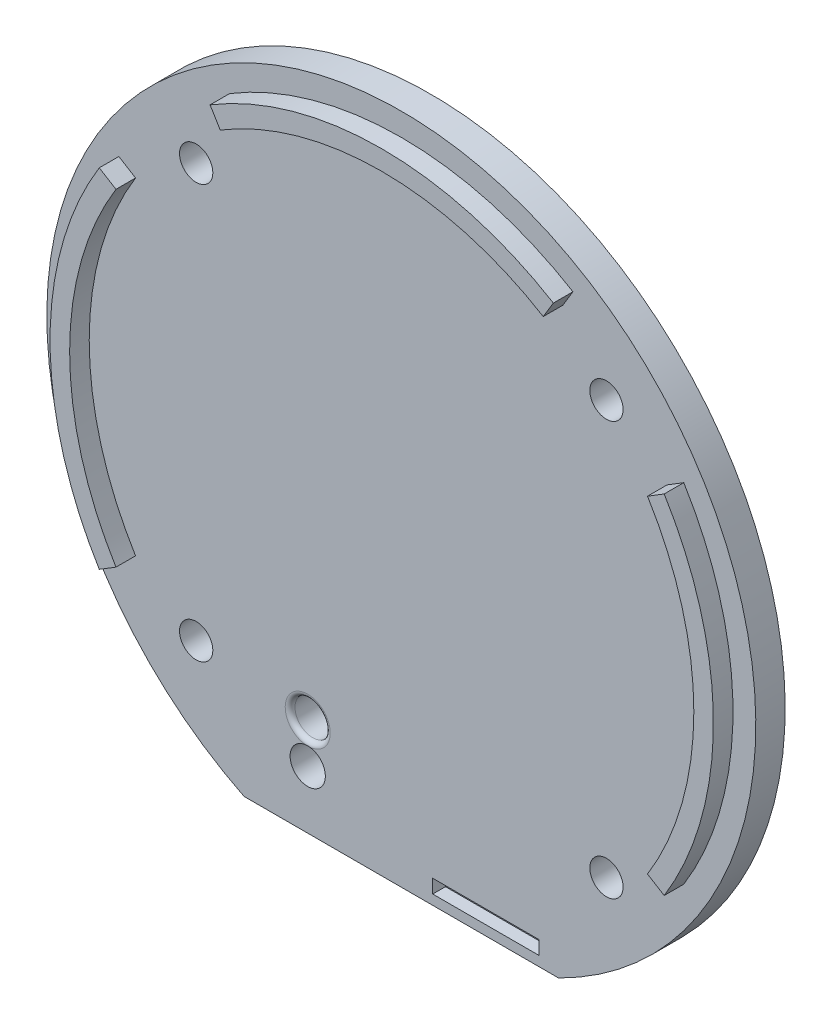
from build123d import *

# Parameters (mm, degrees)
BOSS_EXTRUDE1_DEPTH = 3
SKETCH2_R           = 1.7
CUT_EXTRUDE1_DEPTH  = 3
BOSS_EXTRUDE2_DEPTH = 2
SKETCH6_R           = 1.8
CUT_EXTRUDE2_DEPTH  = 3
SKETCH8_W           = 10.85
SKETCH8_H           = 1.4
CUT_EXTRUDE4_DEPTH  = 1.3
FILLET2_R           = 0.5


with BuildPart() as part:
    # Sketch1 → Boss-Extrude1 (new body)
    with BuildSketch(Plane.XY):
        with BuildLine():
            Line((-16.06, -32.453666973), (16.06, -32.453666973))
            ThreePointArc((16.06, -32.453666973), (0, 36.21), (-16.06, -32.453666973))
        make_face()
    extrude(amount=BOSS_EXTRUDE1_DEPTH)

    # Sketch2 → Cut-Extrude1 (cut)
    with BuildSketch(Plane.XY.offset(3)):
        with Locations((-20.955, 21.12)):
            Circle(SKETCH2_R)
        with Locations((20.955, 21.12)):
            Circle(SKETCH2_R)
        with Locations((-20.955, -21.12)):
            Circle(SKETCH2_R)
        with Locations((20.955, -21.12)):
            Circle(SKETCH2_R)
    extrude(amount=-CUT_EXTRUDE1_DEPTH, mode=Mode.SUBTRACT)

    # Sketch4 → Boss-Extrude2 (add)
    with BuildSketch(Plane.XY.offset(3)):
        with BuildLine():
            Line((-17.534144761, 28.989794195), (-16.499071281, 27.278472224))
            ThreePointArc((-16.499071281, 27.278472224), (0, 31.88), (16.499071281, 27.278472224))
            Line((16.499071281, 27.278472224), (17.534144761, 28.989794195))
            ThreePointArc((17.534144761, 28.989794195), (0, 33.88), (-17.534144761, 28.989794195))
        make_face()
        with BuildLine():
            Line((-28.851381969, 17.760972903), (-27.148230731, 16.712509332))
            ThreePointArc((-27.148230731, 16.712509332), (-31.88, 0), (-27.148230731, -16.712509332))
            Line((-27.148230731, -16.712509332), (-28.851381969, -17.760972903))
            ThreePointArc((-28.851381969, -17.760972903), (-33.88, 0), (-28.851381969, 17.760972903))
        make_face()
        with BuildLine():
            Line((28.851381969, 17.760972903), (27.148230731, 16.712509332))
            ThreePointArc((27.148230731, 16.712509332), (31.88, 0), (27.148230731, -16.712509332))
            Line((27.148230731, -16.712509332), (28.851381969, -17.760972903))
            ThreePointArc((28.851381969, -17.760972903), (33.88, 0), (28.851381969, 17.760972903))
        make_face()
    extrude(amount=BOSS_EXTRUDE2_DEPTH)

    # Sketch6 → Cut-Extrude2 (cut)
    with BuildSketch(Plane(origin=(0, 0, 0), x_dir=(-1, 0, 0), z_dir=(0, 0, -1))):
        with Locations((9.56, -22.453666973)):
            Circle(SKETCH6_R)
        with Locations((9.56, -26.523666973)):
            Circle(SKETCH6_R)
    extrude(amount=-CUT_EXTRUDE2_DEPTH, mode=Mode.SUBTRACT)

    # Sketch8 → Cut-Extrude4 (cut)
    with BuildSketch(Plane.XY.offset(3)):
        with Locations((8.635, -30.753666973)):
            Rectangle(SKETCH8_W, SKETCH8_H)
    extrude(amount=-CUT_EXTRUDE4_DEPTH, mode=Mode.SUBTRACT)

    # Fillet2
    fillet2_edges = [part.edges().sort_by_distance(p)[0] for p in [
        (-7.76, -22.453666973, 3),
    ]]
    fillet(fillet2_edges, radius=FILLET2_R)


solid = part.part
